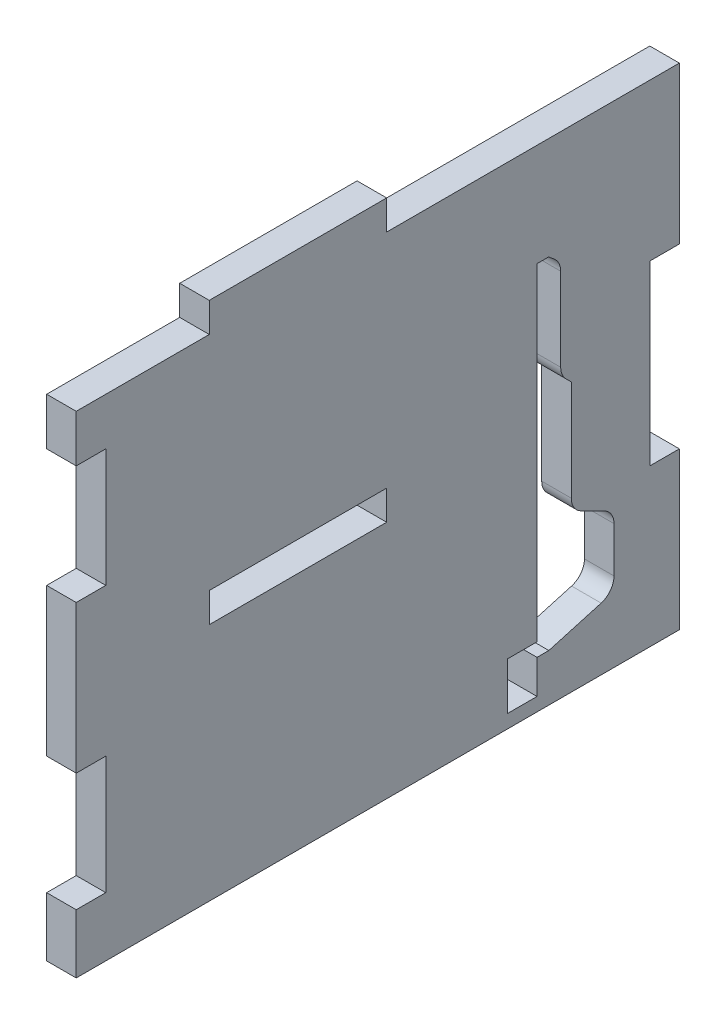
from build123d import *

# Parameters (mm, degrees)
SKETCH_1_W      = 30
SKETCH_1_H      = 5
EXTRUDE_1_DEPTH = 5


with BuildPart() as part:
    # 草图1 → 凸台-拉伸1 (new body)
    with BuildSketch(Plane(origin=(0, 0, 0), x_dir=(0, 0, -1), z_dir=(1, 0, 0))):
        Polygon((-71.794387691, -30.467986568), (30.205612309, -30.467986568), (30.205612309, -3.967986568), (25.205612309, -3.967986568), (25.205612309, 26.032013432), (30.205612309, 26.032013432), (30.205612309, 52.532013432), (-19.294387691, 52.532013432), (-19.294387691, 57.532013432), (-49.294387691, 57.532013432), (-49.294387691, 52.532013432), (-71.794387691, 52.532013432), (-71.794387691, 44.532013432), (-66.794387691, 44.532013432), (-66.794387691, 24.532013432), (-71.794387691, 24.532013432), (-71.794387691, -0.467986568), (-66.794387691, -0.467986568), (-66.794387691, -20.467986568), (-71.794387691, -20.467986568), align=None)
        with Locations((-34.294387691, 12.532013432)):
            Rectangle(SKETCH_1_W, SKETCH_1_H, mode=Mode.SUBTRACT)
        with BuildLine():
            Line((6.101172562, -20.197681499), (6.101172562, 35.190002139))
            Line((6.101172562, 35.190002139), (8.101172562, 35.190013424))
            Line((8.101172562, 35.190013424), (9.065260801, 34.381164181))
            ThreePointArc((9.065260801, 34.381164181), (9.8559397, 33.350845179), (10.137061428, 32.082893705))
            Line((10.137061428, 32.082893705), (10.137061428, 18.013655336))
            ThreePointArc((10.137061428, 18.013655336), (10.36542283, 16.865605039), (11.015741084, 15.892334992))
            Line((11.015741084, 15.892334992), (11.926129512, 14.981946565))
            Line((11.926129512, 14.981946565), (11.926129512, -2.055830909))
            ThreePointArc((11.926129512, -2.055830909), (12.372134093, -3.629713816), (13.577534447, -4.735624064))
            Line((13.577534447, -4.735624064), (17.504207374, -6.71170633))
            ThreePointArc((17.504207374, -6.71170633), (18.709607728, -7.817616578), (19.155612309, -9.391499485))
            Line((19.155612309, -9.391499485), (19.155612309, -17.062905379))
            ThreePointArc((19.155612309, -17.062905379), (18.550098161, -18.870234212), (16.977987304, -19.947987591))
            Line((16.977987304, -19.947987591), (8.137246436, -22.467986568))
            Line((8.137246436, -22.467986568), (6.137246436, -22.467986568))
            Line((6.137246436, -22.467986568), (6.137246436, -28.197986568))
            Line((6.137246436, -28.197986568), (1.137246436, -28.197986568))
            Line((1.137246436, -28.197986568), (1.137246436, -20.197681499))
            Line((1.137246436, -20.197681499), (6.101172562, -20.197681499))
        make_face(mode=Mode.SUBTRACT)
    extrude(amount=EXTRUDE_1_DEPTH)


solid = part.part
